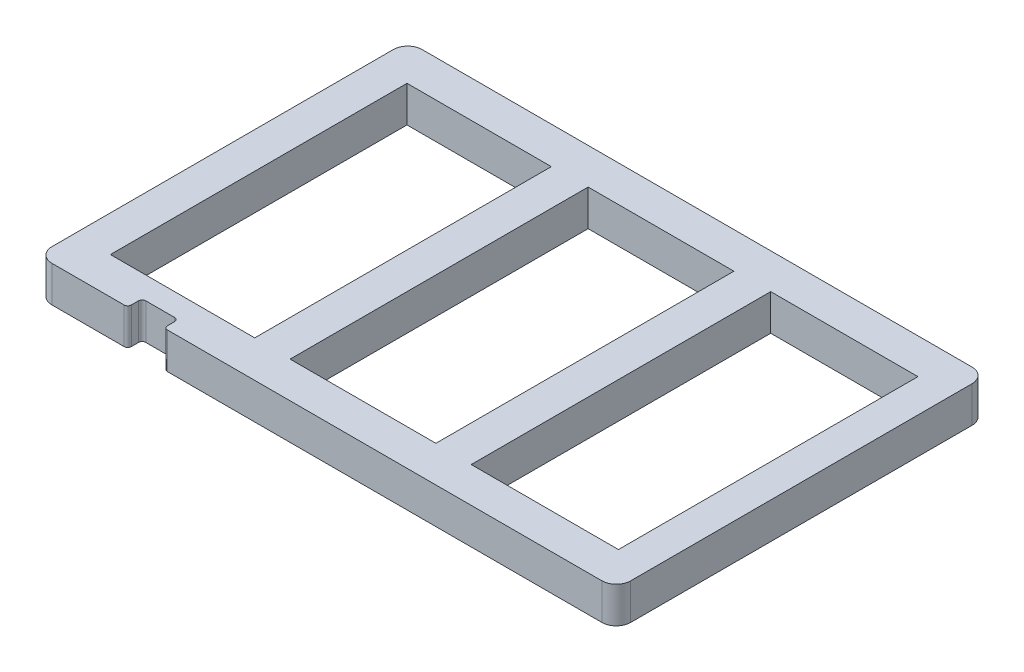
from build123d import *

# Parameters (mm, degrees)
SKETCH1_W           = 20
SKETCH1_H           = 41.1
SKETCH1_W_2         = 20.2
SKETCH1_H_2         = 41.3
SKETCH1_W_3         = 20.4
SKETCH1_H_3         = 41.5
BOSS_EXTRUDE1_DEPTH = 5


with BuildPart() as part:
    # Sketch1 → Boss-Extrude1 (new body)
    with BuildSketch(Plane(origin=(0, 0, 0), x_dir=(1, 0, 0), z_dir=(0, 1, 0))):
        with BuildLine():
            Line((-2.5, -25.15), (-2.5, -24.15))
            ThreePointArc((-2.5, -24.15), (-2.353553391, -23.796446609), (-2, -23.65))
            Line((-2, -23.65), (2, -23.65))
            ThreePointArc((2, -23.65), (2.353553391, -23.796446609), (2.5, -24.15))
            Line((2.5, -24.15), (2.5, -25.15))
            ThreePointArc((2.5, -25.15), (2.646446609, -25.503553391), (3, -25.65))
            Line((3, -25.65), (63.2, -25.65))
            ThreePointArc((63.2, -25.65), (64.614213562, -25.064213562), (65.2, -23.65))
            Line((65.2, -23.65), (65.2, 23.65))
            ThreePointArc((65.2, 23.65), (64.614213562, 25.064213562), (63.2, 25.65))
            Line((63.2, 25.65), (-13, 25.65))
            ThreePointArc((-13, 25.65), (-14.414213562, 25.064213562), (-15, 23.65))
            Line((-15, 23.65), (-15, -23.65))
            ThreePointArc((-15, -23.65), (-14.414213562, -25.064213562), (-13, -25.65))
            Line((-13, -25.65), (-3, -25.65))
            ThreePointArc((-3, -25.65), (-2.646446609, -25.503553391), (-2.5, -25.15))
        make_face()
        Rectangle(SKETCH1_W, SKETCH1_H, mode=Mode.SUBTRACT)
        with Locations((25.1, 0)):
            Rectangle(SKETCH1_W_2, SKETCH1_H_2, mode=Mode.SUBTRACT)
        with Locations((50.4, 0)):
            Rectangle(SKETCH1_W_3, SKETCH1_H_3, mode=Mode.SUBTRACT)
    extrude(amount=BOSS_EXTRUDE1_DEPTH)


solid = part.part
